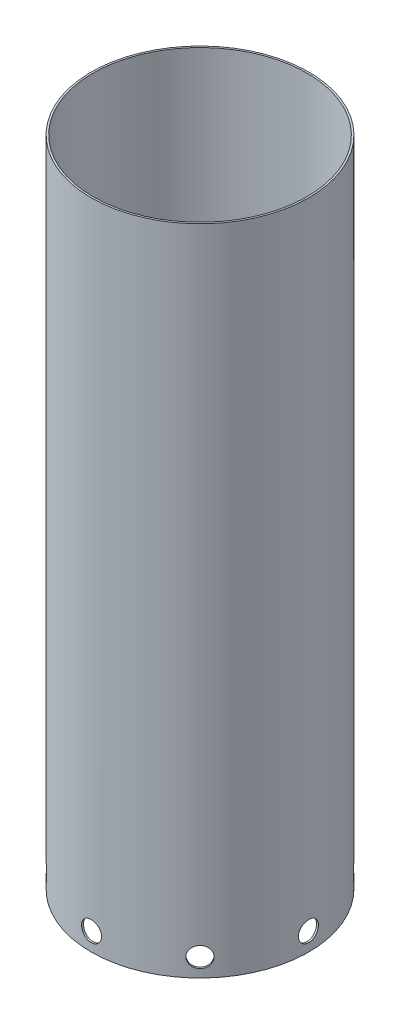
from build123d import *

# Parameters (mm, degrees)
SKETCH2_R                           = 76.2
SKETCH2_R_2                         = 74.93
BOSS_EXTRUDE1_DEPTH                 = 457.2
N2_TO_LOX_LOX_SIDE_HOLES_REACH      = 496.485
N2_TO_LOX_LOX_SIDE_HOLES_END_RADIUS = 76.2
SKETCH5_R                           = 6.985
CIRPATTERN3_COUNT                   = 8


with BuildPart() as part:
    # Sketch2 → Boss-Extrude1 (new body)
    with BuildSketch(Plane(origin=(0, 0, 0), x_dir=(1, 0, 0), z_dir=(0, 1, 0))):
        with Locations(Location((0, 0, 0), (0, 0, 270))):
            Circle(SKETCH2_R)
        with Locations(Location((0, 0, 0), (0, 0, 270))):
            Circle(SKETCH2_R_2, mode=Mode.SUBTRACT)
    extrude(amount=BOSS_EXTRUDE1_DEPTH)

    # N2 to LOX, LOX Side Holes: up to this cylinder (the profile starts inside it)
    n2_to_lox_lox_side_holes_end = Plane(origin=(0, 12.7, 0), z_dir=(0, -1, 0)) * Cylinder(N2_TO_LOX_LOX_SIDE_HOLES_END_RADIUS, 1146.37, mode=Mode.PRIVATE)
    # Sketch5 → N2 to LOX, LOX Side Holes (cut, up to the surface)
    with BuildSketch(Plane(origin=(0, -25.4, 0), x_dir=(0, 0, 1), z_dir=(1, 0, 0)), mode=Mode.PRIVATE) as n2_to_lox_lox_side_holes_sk1:
        with Locations((0, -38.1)):
            Circle(SKETCH5_R)
    n2_to_lox_lox_side_holes_tool1 = extrude(n2_to_lox_lox_side_holes_sk1.sketch, amount=N2_TO_LOX_LOX_SIDE_HOLES_REACH, mode=Mode.PRIVATE) & n2_to_lox_lox_side_holes_end
    n2_to_lox_lox_side_holes = n2_to_lox_lox_side_holes_tool1.solids().sort_by_distance((0, 12.7, 0))[0]
    add(n2_to_lox_lox_side_holes, mode=Mode.SUBTRACT)

    # CirPattern3: N2 to LOX, LOX Side Holes ×8 about axis
    cirpattern3_axis = Axis((0, 0, 0), (0, 1, 0))
    for i in range(1, CIRPATTERN3_COUNT):
        add(n2_to_lox_lox_side_holes.rotate(cirpattern3_axis, i * 360 / CIRPATTERN3_COUNT), mode=Mode.SUBTRACT)


solid = part.part
